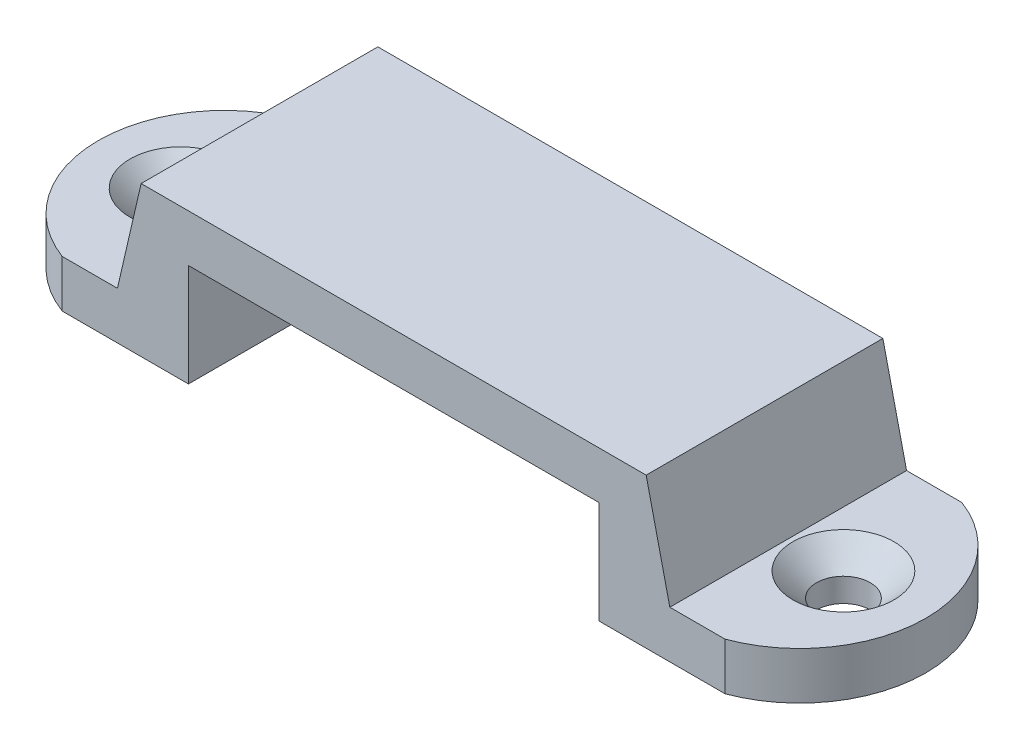
from build123d import *

# Parameters (mm, degrees)
BOSS_EXTRUDE1_DEPTH                                 = 15
BOSS_EXTRUDE2_DEPTH                                 = 3
CSK_FOR_M3_COUNTERSUNK_FLAT_HEAD_SCREW1_D           = 3.4
CSK_FOR_M3_COUNTERSUNK_FLAT_HEAD_SCREW1_DEPTH       = 64
CSK_FOR_M3_COUNTERSUNK_FLAT_HEAD_SCREW1_CSINK_D     = 6.4
CSK_FOR_M3_COUNTERSUNK_FLAT_HEAD_SCREW1_CSINK_ANGLE = 90
CSK_FOR_M3_COUNTERSUNK_FLAT_HEAD_SCREW1_TIP         = 1.021463052


with BuildPart() as part:
    # Sketch2 → Boss-Extrude1 (new body)
    with BuildSketch(Plane.XY):
        Polygon((1.5, 6.5), (0, 0), (-3.5, 0), (-3.5, -3), (4.5, -3), (4.5, 3.5), (30.5, 3.5), (30.5, -3), (38.5, -3), (38.5, 0), (35, 0), (33.5, 6.5), align=None)
    extrude(amount=BOSS_EXTRUDE1_DEPTH)

    # Sketch3 → Boss-Extrude2 (add)
    with BuildSketch(Plane(origin=(0, 0, 0), x_dir=(1, 0, 0), z_dir=(0, 1, 0))):
        with BuildLine():
            Line((-3.5, 0), (-3.5, -15))
            ThreePointArc((-3.5, -15), (-8.716117819, -7.5), (-3.5, 0))
        make_face()
        with BuildLine():
            Line((38.5, 0), (38.5, -15))
            ThreePointArc((38.5, -15), (43.716117819, -7.5), (38.5, 0))
        make_face()
    extrude(amount=-BOSS_EXTRUDE2_DEPTH)

    # CSK for M3 Countersunk Flat Head Screw1
    with Locations(Plane(origin=(0, 0, 0), x_dir=(1, 0, 0), z_dir=(0, 1, 0))):
        with Locations((-3.5, -7.5), (38.5, -7.5)):
            CounterSinkHole(CSK_FOR_M3_COUNTERSUNK_FLAT_HEAD_SCREW1_D / 2, CSK_FOR_M3_COUNTERSUNK_FLAT_HEAD_SCREW1_CSINK_D / 2, depth=CSK_FOR_M3_COUNTERSUNK_FLAT_HEAD_SCREW1_DEPTH, counter_sink_angle=CSK_FOR_M3_COUNTERSUNK_FLAT_HEAD_SCREW1_CSINK_ANGLE)
            with Locations((0, 0, -(CSK_FOR_M3_COUNTERSUNK_FLAT_HEAD_SCREW1_DEPTH + CSK_FOR_M3_COUNTERSUNK_FLAT_HEAD_SCREW1_TIP / 2))):  # 118° drill point
                Cone(0, CSK_FOR_M3_COUNTERSUNK_FLAT_HEAD_SCREW1_D / 2, CSK_FOR_M3_COUNTERSUNK_FLAT_HEAD_SCREW1_TIP, mode=Mode.SUBTRACT)


solid = part.part
